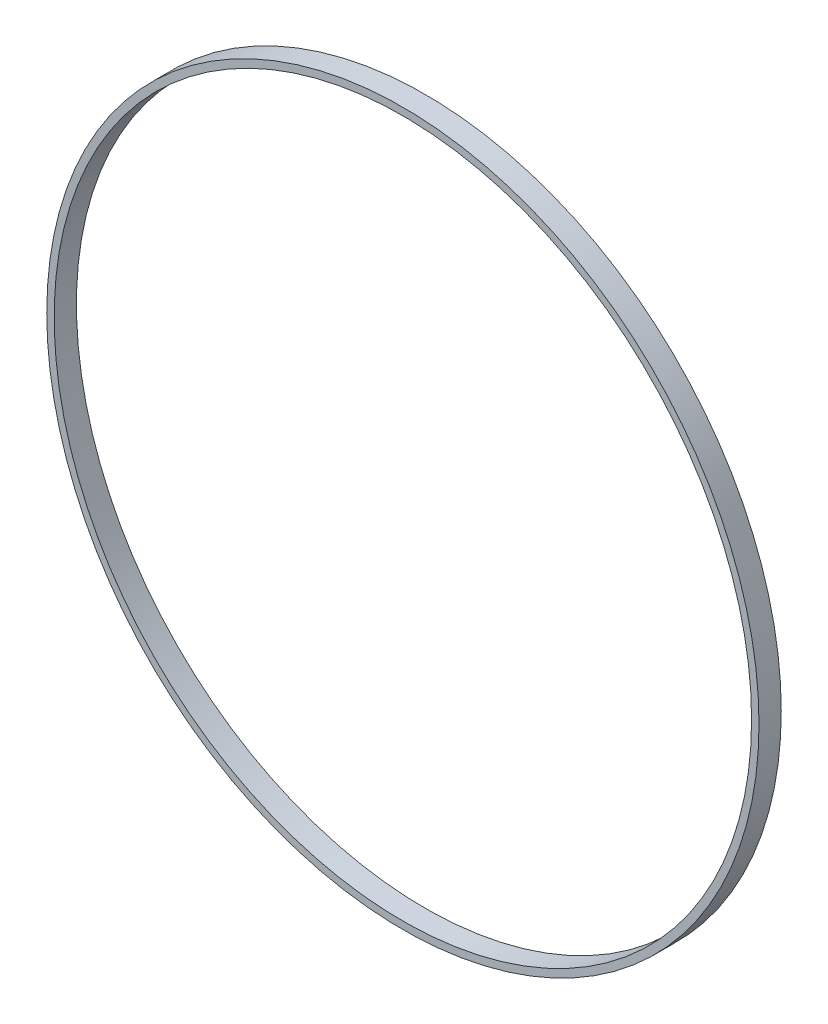
from build123d import *

# Parameters (mm, degrees)
SKETCH1_R           = 120
SKETCH1_R_2         = 117.5
BOSS_EXTRUDE1_DEPTH = 7.5


with BuildPart() as part:
    # Sketch1 → Boss-Extrude1 (new body)
    with BuildSketch(Plane.XY):
        Circle(SKETCH1_R)
        Circle(SKETCH1_R_2, mode=Mode.SUBTRACT)
    extrude(amount=BOSS_EXTRUDE1_DEPTH)


solid = part.part
